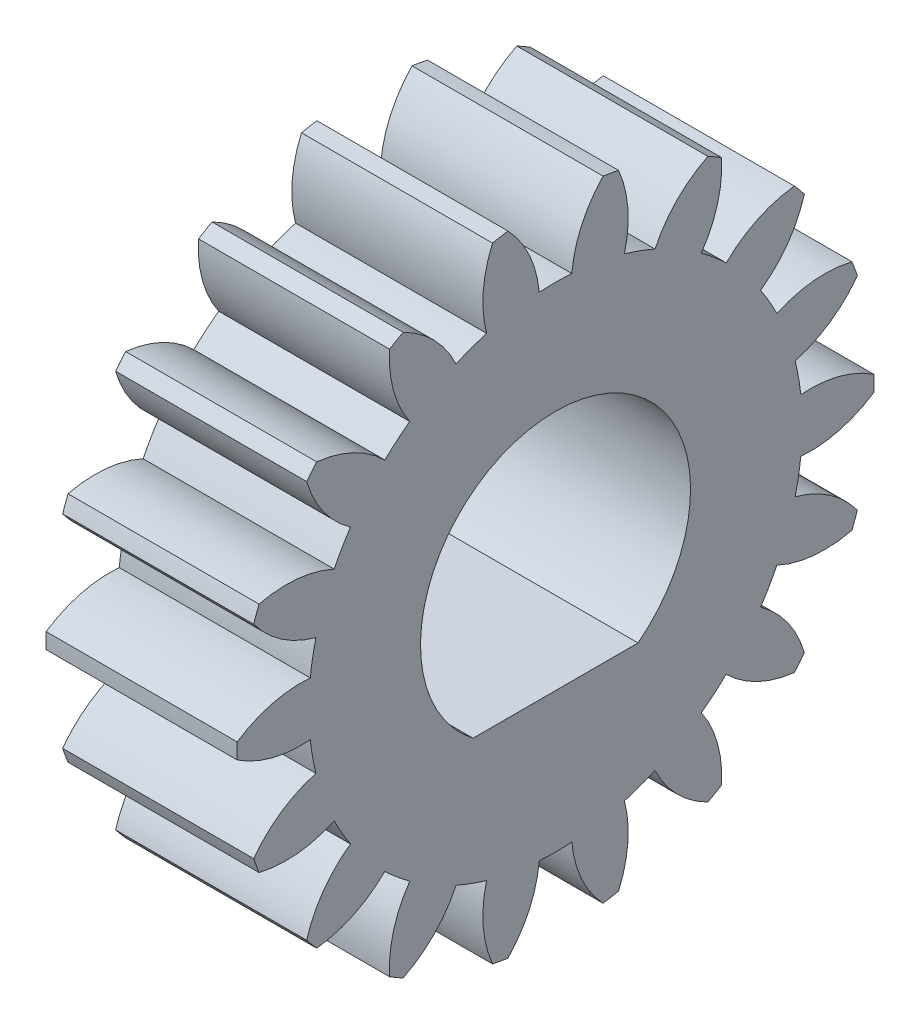
from build123d import *

# Parameters (mm, degrees)
BASPROSKE_W        = 4
BASPROSKE_H        = 5
TOOTHCUT_DEPTH     = 9.124038405
TEETHCUTS_COUNT    = 18
TEETHCUTS_ANGLE    = 340
BORE_DEPTH         = 50.0000508
CUT_EXTRUDE1_DEPTH = 1


with BuildPart() as part:
    # BasProSke → Base-Revolve (revolve)
    with BuildSketch(Plane(origin=(0, 0, 0), x_dir=(1, 0, 0), z_dir=(0, 1, 0)), mode=Mode.PRIVATE) as base_revolve_sk:
        with Locations((2, 2.5)):
            Rectangle(BASPROSKE_W, BASPROSKE_H)
    revolve(base_revolve_sk.sketch.rotate(Axis((-10, 0, 0), (1, 0, 0)), 180), axis=Axis((-10, 0, 0), (1, 0, 0)))

    # TooCutSke → ToothCut (cut, through all)
    with BuildSketch(Plane(origin=(0, 0, 0), x_dir=(0, 0, -1), z_dir=(1, 0, 0))):
        with BuildLine():
            ThreePointArc((0.25527463, 3.865580275), (0, 3.874), (-0.25527463, 3.865580275))
            ThreePointArc((-0.25527463, 3.865580275), (-0.416281865, 4.46052923), (-0.768562654, 4.96628197))
            ThreePointArc((-0.768562654, 4.96628197), (0, 5.0254), (0.768562654, 4.96628197))
            ThreePointArc((0.768562654, 4.96628197), (0.416281865, 4.46052923), (0.25527463, 3.865580275))
        make_face()
    toothcut = extrude(amount=TOOTHCUT_DEPTH, mode=Mode.SUBTRACT)

    # TeethCuts: ToothCut ×18 about axis
    teethcuts_axis = Axis((-10, 0, 0), (1, 0, 0))
    for i in range(1, TEETHCUTS_COUNT):
        add(toothcut.rotate(teethcuts_axis, i * TEETHCUTS_ANGLE / (TEETHCUTS_COUNT - 1)), mode=Mode.SUBTRACT)

    # BorSke → Bore (cut, symmetric)
    with BuildSketch(Plane(origin=(0, 0, 0), x_dir=(0, 0, -1), z_dir=(1, 0, 0))):
        with BuildLine():
            Line((-1.295364774, -1.678222304), (1.295364774, -1.678222304))
            ThreePointArc((1.295364774, -1.678222304), (0, 2.12), (-1.295364774, -1.678222304))
        make_face()
    extrude(amount=BORE_DEPTH, both=True, mode=Mode.SUBTRACT)

    # Sketch1 → Cut-Extrude1 (cut)
    with BuildSketch(Plane.ZY):
        with BuildLine():
            ThreePointArc((3.220053404, 2.153864452), (3.645784857, 2.578031095), (3.908157867, 3.118701988))
            ThreePointArc((3.908157867, 3.118701988), (3.830222216, 3.213938048), (3.749966389, 3.30722725))
            ThreePointArc((3.749966389, 3.30722725), (3.171948906, 3.142726791), (2.680298817, 2.79711892))
            ThreePointArc((2.680298817, 2.79711892), (2.4901592, 2.967656173), (2.289195394, 3.125293658))
            ThreePointArc((2.289195394, 3.125293658), (2.544178562, 3.669488655), (2.605808207, 4.267289958))
            ThreePointArc((2.605808207, 4.267289958), (2.5, 4.330127019), (2.392677406, 4.390341084))
            ThreePointArc((2.392677406, 4.390341084), (1.905781113, 4.038067594), (1.561986006, 3.545148194))
            ThreePointArc((1.561986006, 3.545148194), (1.324986035, 3.640369213), (1.082226634, 3.719766325))
            ThreePointArc((1.082226634, 3.719766325), (1.135706785, 4.318351728), (0.98915962, 4.901179781))
            ThreePointArc((0.98915962, 4.901179781), (0.868240888, 4.924038765), (0.746796215, 4.943914988))
            ThreePointArc((0.746796215, 4.943914988), (0.409747992, 4.44635785), (0.25527463, 3.865580275))
            ThreePointArc((0.25527463, 3.865580275), (0, 3.874), (-0.25527463, 3.865580275))
            ThreePointArc((-0.25527463, 3.865580275), (-0.409747992, 4.44635785), (-0.746796215, 4.943914988))
            ThreePointArc((-0.746796215, 4.943914988), (-0.868240888, 4.924038765), (-0.98915962, 4.901179781))
            ThreePointArc((-0.98915962, 4.901179781), (-1.135706785, 4.318351728), (-1.082226634, 3.719766325))
            ThreePointArc((-1.082226634, 3.719766325), (-1.324986035, 3.640369213), (-1.561986006, 3.545148194))
            ThreePointArc((-1.561986006, 3.545148194), (-1.905781113, 4.038067594), (-2.392677406, 4.390341084))
            ThreePointArc((-2.392677406, 4.390341084), (-2.5, 4.330127019), (-2.605808207, 4.267289958))
            ThreePointArc((-2.605808207, 4.267289958), (-2.544178562, 3.669488655), (-2.289195394, 3.125293658))
            ThreePointArc((-2.289195394, 3.125293658), (-2.4901592, 2.967656173), (-2.680298817, 2.79711892))
            ThreePointArc((-2.680298817, 2.79711892), (-3.171948906, 3.142726791), (-3.749966389, 3.30722725))
            ThreePointArc((-3.749966389, 3.30722725), (-3.830222216, 3.213938048), (-3.908157867, 3.118701988))
            ThreePointArc((-3.908157867, 3.118701988), (-3.645784857, 2.578031095), (-3.220053404, 2.153864452))
            ThreePointArc((-3.220053404, 2.153864452), (-3.354982414, 1.937), (-3.475328033, 1.711715823))
            ThreePointArc((-3.475328033, 1.711715823), (-4.055532848, 1.868326755), (-4.654954082, 1.825213))
            ThreePointArc((-4.654954082, 1.825213), (-4.698463104, 1.710100717), (-4.739126009, 1.593952531))
            ThreePointArc((-4.739126009, 1.593952531), (-4.307655691, 1.175624937), (-3.762525451, 0.922647405))
            ThreePointArc((-3.762525451, 0.922647405), (-3.815145235, 0.67271304), (-3.851181399, 0.419854536))
            ThreePointArc((-3.851181399, 0.419854536), (-4.449959675, 0.368578939), (-4.998485613, 0.123051126))
            ThreePointArc((-4.998485613, 0.123051126), (-5, 0), (-4.998485613, -0.123051126))
            ThreePointArc((-4.998485613, -0.123051126), (-4.449959675, -0.368578939), (-3.851181399, -0.419854536))
            ThreePointArc((-3.851181399, -0.419854536), (-3.815145235, -0.67271304), (-3.762525451, -0.922647405))
            ThreePointArc((-3.762525451, -0.922647405), (-4.307655691, -1.175624937), (-4.739126009, -1.593952531))
            ThreePointArc((-4.739126009, -1.593952531), (-4.698463104, -1.710100717), (-4.654954082, -1.825213))
            ThreePointArc((-4.654954082, -1.825213), (-4.055532848, -1.868326755), (-3.475328033, -1.711715823))
            ThreePointArc((-3.475328033, -1.711715823), (-3.354982414, -1.937), (-3.220053404, -2.153864452))
            ThreePointArc((-3.220053404, -2.153864452), (-3.645784857, -2.578031095), (-3.908157867, -3.118701988))
            ThreePointArc((-3.908157867, -3.118701988), (-3.830222216, -3.213938048), (-3.749966389, -3.30722725))
            ThreePointArc((-3.749966389, -3.30722725), (-3.171948906, -3.142726791), (-2.680298817, -2.79711892))
            ThreePointArc((-2.680298817, -2.79711892), (-2.4901592, -2.967656173), (-2.289195394, -3.125293658))
            ThreePointArc((-2.289195394, -3.125293658), (-2.544178562, -3.669488655), (-2.605808207, -4.267289958))
            ThreePointArc((-2.605808207, -4.267289958), (-2.5, -4.330127019), (-2.392677406, -4.390341084))
            ThreePointArc((-2.392677406, -4.390341084), (-1.905781113, -4.038067594), (-1.561986006, -3.545148194))
            ThreePointArc((-1.561986006, -3.545148194), (-1.324986035, -3.640369213), (-1.082226634, -3.719766325))
            ThreePointArc((-1.082226634, -3.719766325), (-1.135706785, -4.318351728), (-0.98915962, -4.901179781))
            ThreePointArc((-0.98915962, -4.901179781), (-0.868240888, -4.924038765), (-0.746796215, -4.943914988))
            ThreePointArc((-0.746796215, -4.943914988), (-0.409747992, -4.44635785), (-0.25527463, -3.865580275))
            ThreePointArc((-0.25527463, -3.865580275), (0, -3.874), (0.25527463, -3.865580275))
            ThreePointArc((0.25527463, -3.865580275), (0.409747992, -4.44635785), (0.746796215, -4.943914988))
            ThreePointArc((0.746796215, -4.943914988), (0.868240888, -4.924038765), (0.98915962, -4.901179781))
            ThreePointArc((0.98915962, -4.901179781), (1.135706785, -4.318351728), (1.082226634, -3.719766325))
            ThreePointArc((1.082226634, -3.719766325), (1.324986035, -3.640369213), (1.561986006, -3.545148194))
            ThreePointArc((1.561986006, -3.545148194), (1.905781113, -4.038067594), (2.392677406, -4.390341084))
            ThreePointArc((2.392677406, -4.390341084), (2.5, -4.330127019), (2.605808207, -4.267289958))
            ThreePointArc((2.605808207, -4.267289958), (2.544178562, -3.669488655), (2.289195394, -3.125293658))
            ThreePointArc((2.289195394, -3.125293658), (2.4901592, -2.967656173), (2.680298817, -2.79711892))
            ThreePointArc((2.680298817, -2.79711892), (3.171948906, -3.142726791), (3.749966389, -3.30722725))
            ThreePointArc((3.749966389, -3.30722725), (3.830222216, -3.213938048), (3.908157867, -3.118701988))
            ThreePointArc((3.908157867, -3.118701988), (3.645784857, -2.578031095), (3.220053404, -2.153864452))
            ThreePointArc((3.220053404, -2.153864452), (3.354982414, -1.937), (3.475328033, -1.711715823))
            ThreePointArc((3.475328033, -1.711715823), (4.055532848, -1.868326755), (4.654954082, -1.825213))
            ThreePointArc((4.654954082, -1.825213), (4.698463104, -1.710100717), (4.739126009, -1.593952531))
            ThreePointArc((4.739126009, -1.593952531), (4.307655691, -1.175624937), (3.762525451, -0.922647405))
            ThreePointArc((3.762525451, -0.922647405), (3.815145235, -0.67271304), (3.851181399, -0.419854536))
            ThreePointArc((3.851181399, -0.419854536), (4.449959675, -0.368578939), (4.998485613, -0.123051126))
            ThreePointArc((4.998485613, -0.123051126), (5, 0), (4.998485613, 0.123051126))
            ThreePointArc((4.998485613, 0.123051126), (4.449959675, 0.368578939), (3.851181399, 0.419854536))
            ThreePointArc((3.851181399, 0.419854536), (3.815145235, 0.67271304), (3.762525451, 0.922647405))
            ThreePointArc((3.762525451, 0.922647405), (4.307655691, 1.175624937), (4.739126009, 1.593952531))
            ThreePointArc((4.739126009, 1.593952531), (4.698463104, 1.710100717), (4.654954082, 1.825213))
            ThreePointArc((4.654954082, 1.825213), (4.055532848, 1.868326755), (3.475328033, 1.711715823))
            ThreePointArc((3.475328033, 1.711715823), (3.354982414, 1.937), (3.220053404, 2.153864452))
        make_face()
    extrude(amount=-CUT_EXTRUDE1_DEPTH, mode=Mode.SUBTRACT)


solid = part.part
